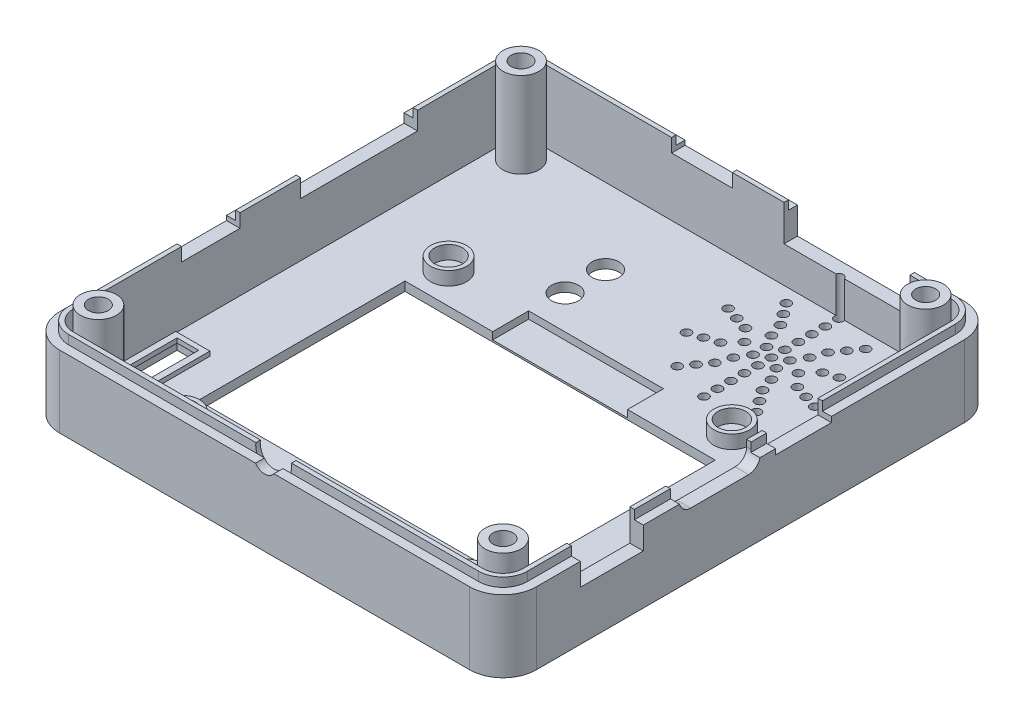
from build123d import *

# Parameters (mm, degrees)
BOSS_EXTRUDE1_DEPTH   = 8
BOSS_EXTRUDE2_DEPTH   = 9
SKETCH1_17_R          = 2
SKETCH1_17_R_2        = 1.1
BOSS_EXTRUDE3_DEPTH   = 10.5
BOSS_EXTRUDE3_2_DEPTH = 10.5
BOSS_EXTRUDE3_3_DEPTH = 10.5
BOSS_EXTRUDE3_4_DEPTH = 10.5
SKETCH1_18_R          = 2
SKETCH1_18_R_2        = 1.1
BOSS_EXTRUDE4_DEPTH   = 1
SKETCH2_W             = 14
SKETCH2_H             = 4
SKETCH2_W_2           = 6.75
SKETCH2_H_2           = 1.5
CUT_EXTRUDE3_DEPTH    = 5
SKETCH4_R             = 1.25
CUT_EXTRUDE4_DEPTH    = 5
SKETCH6_W             = 7
SKETCH6_H             = 3.5
SKETCH6_W_2           = 6.2
SKETCH6_H_2           = 1.6
CUT_EXTRUDE5_DEPTH    = 5
SKETCH7_W             = 13
SKETCH7_H             = 2
SKETCH7_W_2           = 6.5
SKETCH7_H_2           = 1.5
CUT_EXTRUDE6_DEPTH    = 5
SKETCH8_W             = 3
SKETCH8_H             = 8
CUT_EXTRUDE7_DEPTH    = 5
SKETCH9_R             = 2
SKETCH9_R_2           = 1.55
BOSS_EXTRUDE5_DEPTH   = 1.5
SKETCH9_3_W           = 34.5
SKETCH9_3_H           = 23
CUT_EXTRUDE8_DEPTH    = 10
SKETCH10_R            = 2
CUT_EXTRUDE9_DEPTH    = 0.5
SKETCH12_R            = 1.5
CUT_EXTRUDE11_DEPTH   = 10
SKETCH13_R            = 0.5
CUT_EXTRUDE12_DEPTH   = 10
SKETCH18_W            = 15
SKETCH18_H            = 4
CUT_EXTRUDE13_DEPTH   = 0.8
SKETCH21_W            = 3.8
SKETCH21_H            = 8.5
SKETCH21_W_2          = 2.4
SKETCH21_H_2          = 7.4
BOSS_EXTRUDE9_DEPTH   = 0.5


with BuildPart() as part:
    # Sketch1 → Boss-Extrude1 (new body)
    with BuildSketch(Plane(origin=(0, 0, 0), x_dir=(1, 0, 0), z_dir=(0, 1, 0))):
        with BuildLine():
            ThreePointArc((-22.8, 27.5), (-25.41629509, 26.41629509), (-26.5, 23.8))
            Line((-26.5, 23.8), (-26.5, -23.8))
            ThreePointArc((-26.5, -23.8), (-25.41629509, -26.41629509), (-22.8, -27.5))
            Line((-22.8, -27.5), (22.8, -27.5))
            ThreePointArc((22.8, -27.5), (25.41629509, -26.41629509), (26.5, -23.8))
            Line((26.5, -23.8), (26.5, 23.8))
            ThreePointArc((26.5, 23.8), (25.41629509, 26.41629509), (22.8, 27.5))
            Line((22.8, 27.5), (-22.8, 27.5))
        make_face()
        with BuildLine():
            Line((-25.5, -23.8), (-25.5, 23.8))
            ThreePointArc((-25.5, 23.8), (-24.709188309, 25.709188309), (-22.8, 26.5))
            Line((-22.8, 26.5), (22.8, 26.5))
            ThreePointArc((22.8, 26.5), (24.709188309, 25.709188309), (25.5, 23.8))
            Line((25.5, 23.8), (25.5, -23.8))
            ThreePointArc((25.5, -23.8), (24.709188309, -25.709188309), (22.8, -26.5))
            Line((22.8, -26.5), (-22.8, -26.5))
            ThreePointArc((-22.8, -26.5), (-24.709188309, -25.709188309), (-25.5, -23.8))
        make_face(mode=Mode.SUBTRACT)
    extrude(amount=BOSS_EXTRUDE1_DEPTH)

    # Sketch1<16> → Boss-Extrude2 (add)
    with BuildSketch(Plane(origin=(0, 0, 0), x_dir=(1, 0, 0), z_dir=(0, 1, 0))):
        with BuildLine():
            ThreePointArc((-22.8, 26.5), (-24.709188309, 25.709188309), (-25.5, 23.8))
            Line((-25.5, 23.8), (-25.5, -23.8))
            ThreePointArc((-25.5, -23.8), (-24.709188309, -25.709188309), (-22.8, -26.5))
            Line((-22.8, -26.5), (22.8, -26.5))
            ThreePointArc((22.8, -26.5), (24.709188309, -25.709188309), (25.5, -23.8))
            Line((25.5, -23.8), (25.5, 23.8))
            ThreePointArc((25.5, 23.8), (24.709188309, 25.709188309), (22.8, 26.5))
            Line((22.8, 26.5), (-22.8, 26.5))
        make_face()
        with BuildLine():
            ThreePointArc((-25, 23.8), (-24.355634919, 25.355634919), (-22.8, 26))
            Line((-22.8, 26), (22.8, 26))
            ThreePointArc((22.8, 26), (24.355634919, 25.355634919), (25, 23.8))
            Line((25, 23.8), (25, -23.8))
            ThreePointArc((25, -23.8), (24.355634919, -25.355634919), (22.8, -26))
            Line((22.8, -26), (-22.8, -26))
            ThreePointArc((-22.8, -26), (-24.355634919, -25.355634919), (-25, -23.8))
            Line((-25, -23.8), (-25, 23.8))
        make_face(mode=Mode.SUBTRACT)
    extrude(amount=BOSS_EXTRUDE2_DEPTH)



with BuildPart() as body_2:
    # Sketch1<17> → Boss-Extrude3 (new body)
    with BuildSketch(Plane(origin=(0, 0, 0), x_dir=(1, 0, 0), z_dir=(0, 1, 0))):
        with Locations((-22.5, 23.5)):
            Circle(SKETCH1_17_R)
        with Locations((-22.5, 23.5)):
            Circle(SKETCH1_17_R_2, mode=Mode.SUBTRACT)
    extrude(amount=BOSS_EXTRUDE3_DEPTH)


with BuildPart() as body_3:
    # Sketch1<17> → Boss-Extrude3 2 (new body)
    with BuildSketch(Plane(origin=(0, 0, 0), x_dir=(1, 0, 0), z_dir=(0, 1, 0))):
        with Locations((22.5, 23.5)):
            Circle(SKETCH1_17_R)
        with Locations((22.5, 23.5)):
            Circle(SKETCH1_17_R_2, mode=Mode.SUBTRACT)
    extrude(amount=BOSS_EXTRUDE3_2_DEPTH)


with BuildPart() as body_4:
    # Sketch1<17> → Boss-Extrude3 3 (new body)
    with BuildSketch(Plane(origin=(0, 0, 0), x_dir=(1, 0, 0), z_dir=(0, 1, 0))):
        with Locations((22.5, -23.5)):
            Circle(SKETCH1_17_R)
        with Locations((22.5, -23.5)):
            Circle(SKETCH1_17_R_2, mode=Mode.SUBTRACT)
    extrude(amount=BOSS_EXTRUDE3_3_DEPTH)


with BuildPart() as body_5:
    # Sketch1<17> → Boss-Extrude3 4 (new body)
    with BuildSketch(Plane(origin=(0, 0, 0), x_dir=(1, 0, 0), z_dir=(0, 1, 0))):
        with Locations((-22.5, -23.5)):
            Circle(SKETCH1_17_R)
        with Locations((-22.5, -23.5)):
            Circle(SKETCH1_17_R_2, mode=Mode.SUBTRACT)
    extrude(amount=BOSS_EXTRUDE3_4_DEPTH)


with BuildPart() as part_1:
    add(part.part)

    add(body_2.part)  # Boss-Extrude4 merges body 2

    add(body_3.part)  # Boss-Extrude4 merges body 3

    add(body_4.part)  # Boss-Extrude4 merges body 4

    add(body_5.part)  # Boss-Extrude4 merges body 5
    # Sketch1<18> → Boss-Extrude4 (add)
    # profile 1 of 5: a face of its own
    with BuildSketch(Plane(origin=(0, 0, 0), x_dir=(1, 0, 0), z_dir=(0, 1, 0))):
        with BuildLine():
            Line((22.8, 26), (-22.8, 26))
            ThreePointArc((-22.8, 26), (-24.355634919, 25.355634919), (-25, 23.8))
            Line((-25, 23.8), (-25, -23.8))
            ThreePointArc((-25, -23.8), (-24.355634919, -25.355634919), (-22.8, -26))
            Line((-22.8, -26), (22.8, -26))
            ThreePointArc((22.8, -26), (24.355634919, -25.355634919), (25, -23.8))
            Line((25, -23.8), (25, 23.8))
            ThreePointArc((25, 23.8), (24.355634919, 25.355634919), (22.8, 26))
        make_face()
        with Locations((-22.5, -23.5)):
            Circle(SKETCH1_18_R, mode=Mode.SUBTRACT)
        with Locations((22.5, -23.5)):
            Circle(SKETCH1_18_R, mode=Mode.SUBTRACT)
        with Locations((-22.5, 23.5)):
            Circle(SKETCH1_18_R, mode=Mode.SUBTRACT)
        with Locations((22.5, 23.5)):
            Circle(SKETCH1_18_R, mode=Mode.SUBTRACT)
    # profile 2 of 5: a face of its own
    with BuildSketch(Plane(origin=(0, 0, 0), x_dir=(1, 0, 0), z_dir=(0, 1, 0))):
        with Locations((-22.5, 23.5)):
            Circle(SKETCH1_18_R_2)
    # profile 3 of 5: a face of its own
    with BuildSketch(Plane(origin=(0, 0, 0), x_dir=(1, 0, 0), z_dir=(0, 1, 0))):
        with Locations((22.5, 23.5)):
            Circle(SKETCH1_18_R_2)
    # profile 4 of 5: a face of its own
    with BuildSketch(Plane(origin=(0, 0, 0), x_dir=(1, 0, 0), z_dir=(0, 1, 0))):
        with Locations((-22.5, -23.5)):
            Circle(SKETCH1_18_R_2)
    # profile 5 of 5: a face of its own
    with BuildSketch(Plane(origin=(0, 0, 0), x_dir=(1, 0, 0), z_dir=(0, 1, 0))):
        with Locations((22.5, -23.5)):
            Circle(SKETCH1_18_R_2)
    extrude(amount=BOSS_EXTRUDE4_DEPTH)

    # Sketch2 → Cut-Extrude3 (cut)
    with BuildSketch(Plane(origin=(0, 0, -27.5), x_dir=(-1, 0, 0), z_dir=(0, 0, -1))):
        with Locations((-11.25, 7)):
            Rectangle(SKETCH2_W, SKETCH2_H)
        with Locations((4.875, 8.25)):
            Rectangle(SKETCH2_W_2, SKETCH2_H_2)
    extrude(amount=-CUT_EXTRUDE3_DEPTH, mode=Mode.SUBTRACT)

    # Sketch4 → Cut-Extrude4 (cut)
    with BuildSketch(Plane.XY.offset(27.5)):
        with Locations((0, 8.71)):
            Circle(SKETCH4_R)
    extrude(amount=-CUT_EXTRUDE4_DEPTH, mode=Mode.SUBTRACT)

    # Sketch6 → Cut-Extrude5 (cut)
    with BuildSketch(Plane(origin=(26.5, 0, 0), x_dir=(0, 0, -1), z_dir=(1, 0, 0))):
        with Locations((-15.4, 7.25)):
            Rectangle(SKETCH6_W, SKETCH6_H)
        with BuildLine():
            Line((-7.9, 9), (1.1, 9))
            Line((1.1, 9), (1.1, 8.28))
            ThreePointArc((1.1, 8.28), (0.72509668, 7.37490332), (-0.18, 7))
            Line((-0.18, 7), (-6.62, 7))
            ThreePointArc((-6.62, 7), (-7.52509668, 7.37490332), (-7.9, 8.28))
            Line((-7.9, 8.28), (-7.9, 9))
        make_face()
        with Locations((5.92, 8.2)):
            Rectangle(SKETCH6_W_2, SKETCH6_H_2)
    extrude(amount=-CUT_EXTRUDE5_DEPTH, mode=Mode.SUBTRACT)

    # Sketch7 → Cut-Extrude6 (cut)
    with BuildSketch(Plane.ZY.offset(26.5)):
        with Locations((-8, 8)):
            Rectangle(SKETCH7_W, SKETCH7_H)
        with Locations((8.5, 8.25)):
            Rectangle(SKETCH7_W_2, SKETCH7_H_2)
    extrude(amount=-CUT_EXTRUDE6_DEPTH, mode=Mode.SUBTRACT)

    # Sketch8 → Cut-Extrude7 (cut)
    with BuildSketch(Plane.XZ):
        with Locations((-22.75, 17)):
            Rectangle(SKETCH8_W, SKETCH8_H)
    extrude(amount=-CUT_EXTRUDE7_DEPTH, mode=Mode.SUBTRACT)

    # Sketch9 → Boss-Extrude5 (add)
    # profile 1 of 4: a face of its own
    with BuildSketch(Plane(origin=(0, 1, 0), x_dir=(1, 0, 0), z_dir=(0, 1, 0))):
        with Locations((15.75, -21)):
            Circle(SKETCH9_R)
        with Locations((15.75, -21)):
            Circle(SKETCH9_R_2, mode=Mode.SUBTRACT)
    # profile 2 of 4: a face of its own
    with BuildSketch(Plane(origin=(0, 1, 0), x_dir=(1, 0, 0), z_dir=(0, 1, 0))):
        with Locations((-15.75, -21)):
            Circle(SKETCH9_R)
        with Locations((-15.75, -21)):
            Circle(SKETCH9_R_2, mode=Mode.SUBTRACT)
    # profile 3 of 4: a face of its own
    with BuildSketch(Plane(origin=(0, 1, 0), x_dir=(1, 0, 0), z_dir=(0, 1, 0))):
        with Locations((15.75, 8.7)):
            Circle(SKETCH9_R)
        with Locations((15.75, 8.7)):
            Circle(SKETCH9_R_2, mode=Mode.SUBTRACT)
    # profile 4 of 4: a face of its own
    with BuildSketch(Plane(origin=(0, 1, 0), x_dir=(1, 0, 0), z_dir=(0, 1, 0))):
        with Locations((-15.75, 8.7)):
            Circle(SKETCH9_R)
        with Locations((-15.75, 8.7)):
            Circle(SKETCH9_R_2, mode=Mode.SUBTRACT)
    extrude(amount=BOSS_EXTRUDE5_DEPTH)

    # Sketch9<3> → Cut-Extrude8 (cut)
    with BuildSketch(Plane(origin=(0, 1, 0), x_dir=(1, 0, 0), z_dir=(0, 1, 0))):
        with Locations((0, -6.15)):
            Rectangle(SKETCH9_3_W, SKETCH9_3_H)
    extrude(amount=-CUT_EXTRUDE8_DEPTH, mode=Mode.SUBTRACT)

    # Sketch10 → Cut-Extrude9 (cut)
    with BuildSketch(Plane(origin=(0, 0, 26), x_dir=(-1, 0, 0), z_dir=(0, 0, -1))):
        with Locations((0, 8.71)):
            Circle(SKETCH10_R)
    extrude(amount=-CUT_EXTRUDE9_DEPTH, mode=Mode.SUBTRACT)

    # Sketch12 → Cut-Extrude11 (cut)
    with BuildSketch(Plane.XZ):
        with Locations((-7.2, -17.6)):
            Circle(SKETCH12_R)
        with Locations((-7.2, -13.1)):
            Circle(SKETCH12_R)
    extrude(amount=-CUT_EXTRUDE11_DEPTH, mode=Mode.SUBTRACT)

    # Sketch13 → Cut-Extrude12 (cut)
    with BuildSketch(Plane.XZ):
        with Locations((10.5, -18.35)):
            Circle(SKETCH13_R)
        with Locations((10.5, -16.85)):
            Circle(SKETCH13_R)
        with Locations((10.5, -15.35)):
            Circle(SKETCH13_R)
        with Locations((10.5, -13.85)):
            Circle(SKETCH13_R)
        with Locations((10.5, -12.35)):
            Circle(SKETCH13_R)
        with Locations((10.5, -10.85)):
            Circle(SKETCH13_R)
        with Locations((14.908389392, -12.282372542)):
            Circle(SKETCH13_R)
        with Locations((17.632923872, -16.032372542)):
            Circle(SKETCH13_R)
        with Locations((17.632923872, -20.667627458)):
            Circle(SKETCH13_R)
        with Locations((14.908389392, -24.417627458)):
            Circle(SKETCH13_R)
        with Locations((10.5, -25.85)):
            Circle(SKETCH13_R)
        with Locations((6.091610608, -24.417627458)):
            Circle(SKETCH13_R)
        with Locations((3.367076128, -20.667627458)):
            Circle(SKETCH13_R)
        with Locations((3.367076128, -16.032372542)):
            Circle(SKETCH13_R)
        with Locations((6.091610608, -12.282372542)):
            Circle(SKETCH13_R)
        with Locations((14.026711514, -13.495898034)):
            Circle(SKETCH13_R)
        with Locations((16.206339098, -16.495898034)):
            Circle(SKETCH13_R)
        with Locations((16.206339098, -20.204101966)):
            Circle(SKETCH13_R)
        with Locations((14.026711514, -23.204101966)):
            Circle(SKETCH13_R)
        with Locations((10.5, -24.35)):
            Circle(SKETCH13_R)
        with Locations((6.973288486, -23.204101966)):
            Circle(SKETCH13_R)
        with Locations((4.793660902, -20.204101966)):
            Circle(SKETCH13_R)
        with Locations((4.793660902, -16.495898034)):
            Circle(SKETCH13_R)
        with Locations((6.973288486, -13.495898034)):
            Circle(SKETCH13_R)
        with Locations((13.145033635, -14.709423525)):
            Circle(SKETCH13_R)
        with Locations((14.779754323, -16.959423525)):
            Circle(SKETCH13_R)
        with Locations((14.779754323, -19.740576475)):
            Circle(SKETCH13_R)
        with Locations((13.145033635, -21.990576475)):
            Circle(SKETCH13_R)
        with Locations((10.5, -22.85)):
            Circle(SKETCH13_R)
        with Locations((7.854966365, -21.990576475)):
            Circle(SKETCH13_R)
        with Locations((6.220245677, -19.740576475)):
            Circle(SKETCH13_R)
        with Locations((6.220245677, -16.959423525)):
            Circle(SKETCH13_R)
        with Locations((7.854966365, -14.709423525)):
            Circle(SKETCH13_R)
        with Locations((12.621320344, -16.228679656)):
            Circle(SKETCH13_R)
        with Locations((13.5, -18.35)):
            Circle(SKETCH13_R)
        with Locations((12.621320344, -20.471320344)):
            Circle(SKETCH13_R)
        with Locations((10.5, -21.35)):
            Circle(SKETCH13_R)
        with Locations((8.378679656, -20.471320344)):
            Circle(SKETCH13_R)
        with Locations((7.5, -18.35)):
            Circle(SKETCH13_R)
        with Locations((8.378679656, -16.228679656)):
            Circle(SKETCH13_R)
        with Locations((11.799038106, -17.6)):
            Circle(SKETCH13_R)
        with Locations((11.799038106, -19.1)):
            Circle(SKETCH13_R)
        with Locations((10.5, -19.85)):
            Circle(SKETCH13_R)
        with Locations((9.200961894, -19.1)):
            Circle(SKETCH13_R)
        with Locations((9.200961894, -17.6)):
            Circle(SKETCH13_R)
    extrude(amount=-CUT_EXTRUDE12_DEPTH, mode=Mode.SUBTRACT)

    # Sketch18 → Cut-Extrude13 (cut)
    with BuildSketch(Plane(origin=(0, 1, 0), x_dir=(1, 0, 0), z_dir=(0, 1, 0))):
        with Locations((0, 7.35)):
            Rectangle(SKETCH18_W, SKETCH18_H)
    extrude(amount=-CUT_EXTRUDE13_DEPTH, mode=Mode.SUBTRACT)

    # Sketch21 → Boss-Extrude9 (add)
    with BuildSketch(Plane(origin=(0, 1, 0), x_dir=(1, 0, 0), z_dir=(0, 1, 0))):
        with Locations((-22.75, -17)):
            Rectangle(SKETCH21_W, SKETCH21_H)
        with Locations((-22.75, -17)):
            Rectangle(SKETCH21_W_2, SKETCH21_H_2, mode=Mode.SUBTRACT)
    extrude(amount=BOSS_EXTRUDE9_DEPTH)


solid = part_1.part
